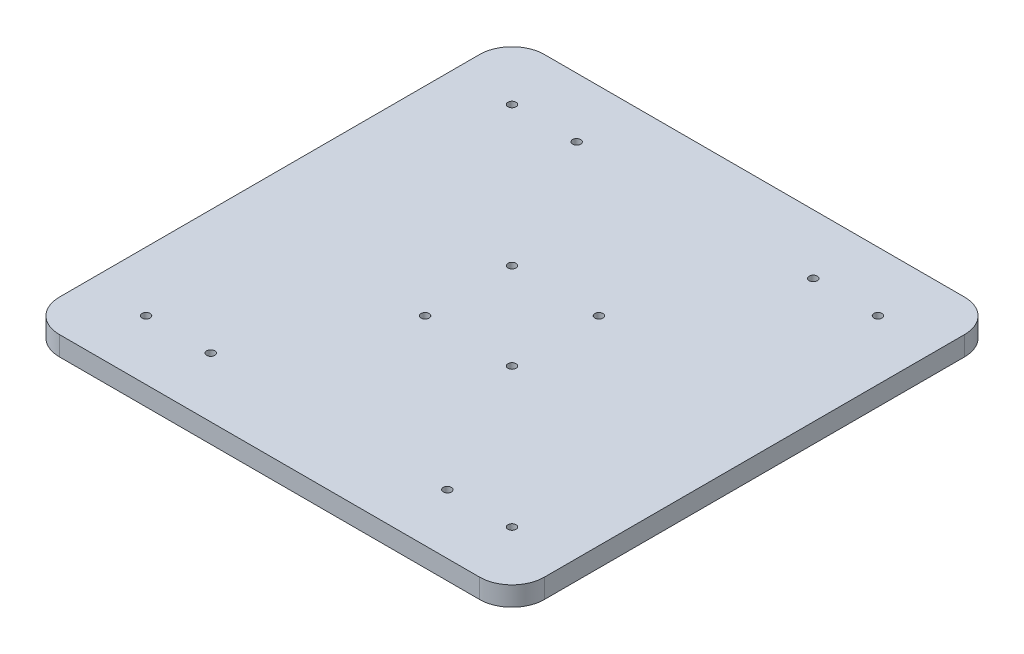
from build123d import *

# Parameters (mm, degrees)
SKETCH_1_W               = 150
SKETCH_1_H               = 150
EXTRUDE_1_DEPTH          = 6
FILLET_1_R               = 10
SKETCH_3_R               = 1.25
CUT_EXTRUDE_4_DEPTH      = 107.235587258
PATTERN_CIRCULAR_2_COUNT = 4
SKETCH_7_R               = 1.25
CUT_EXTRUDE_11_DEPTH     = 10
SKETCH_9_R               = 1.25
CUT_EXTRUDE_12_DEPTH     = 10


with BuildPart() as part:
    # 草图1 → 凸台-拉伸1 (new body)
    with BuildSketch(Plane(origin=(0, 0, 0), x_dir=(1, 0, 0), z_dir=(0, 1, 0))):
        Rectangle(SKETCH_1_W, SKETCH_1_H)
    extrude(amount=EXTRUDE_1_DEPTH)

    # 圆角1
    fillet_1_edges = [part.edges().sort_by_distance(p)[0] for p in [
        (75, 3, 75),
        (-75, 3, 75),
        (-75, 3, -75),
        (75, 3, -75),
    ]]
    fillet(fillet_1_edges, radius=FILLET_1_R)

    # 草图3 → 切除-拉伸4 (cut, through all)
    with BuildSketch(Plane.XZ):
        with Locations(Location((56.568542495, 56.568542495, 0), (0, 0, 270))):
            Circle(SKETCH_3_R)
    cut_extrude_4 = extrude(amount=-CUT_EXTRUDE_4_DEPTH, mode=Mode.SUBTRACT)

    # 阵列(圆周)2: 切除-拉伸4 ×4 about axis
    pattern_circular_2_axis = Axis((-0.01239132, 0, -0.01239132), (0, 1, 0))
    for i in range(1, PATTERN_CIRCULAR_2_COUNT):
        add(cut_extrude_4.rotate(pattern_circular_2_axis, i * 360 / PATTERN_CIRCULAR_2_COUNT), mode=Mode.SUBTRACT)

    # 草图7 → 切除-拉伸11 (cut)
    with BuildSketch(Plane.XZ):
        with Locations(Location((-36.593325134, -56.593325134, 0), (0, 0, 270))):
            Circle(SKETCH_7_R)
        with Locations(Location((36.568542495, -56.593325134, 0), (0, 0, 270))):
            Circle(SKETCH_7_R)
        with Locations(Location((-36.593325134, 56.568542495, 0), (0, 0, 270))):
            Circle(SKETCH_7_R)
        with Locations(Location((36.568542495, 56.568542495, 0), (0, 0, 270))):
            Circle(SKETCH_7_R)
    extrude(amount=-CUT_EXTRUDE_11_DEPTH, mode=Mode.SUBTRACT)

    # 草图9 → 切除-拉伸12 (cut)
    with BuildSketch(Plane.XZ):
        with Locations(Location((13.435028843, 13.435028843, 0), (0, 0, 270))):
            Circle(SKETCH_9_R)
        with Locations(Location((13.435028843, -13.435028843, 0), (0, 0, 270))):
            Circle(SKETCH_9_R)
        with Locations(Location((-13.435028843, -13.435028843, 0), (0, 0, 270))):
            Circle(SKETCH_9_R)
        with Locations(Location((-13.435028843, 13.435028843, 0), (0, 0, 270))):
            Circle(SKETCH_9_R)
    extrude(amount=-CUT_EXTRUDE_12_DEPTH, mode=Mode.SUBTRACT)


solid = part.part
